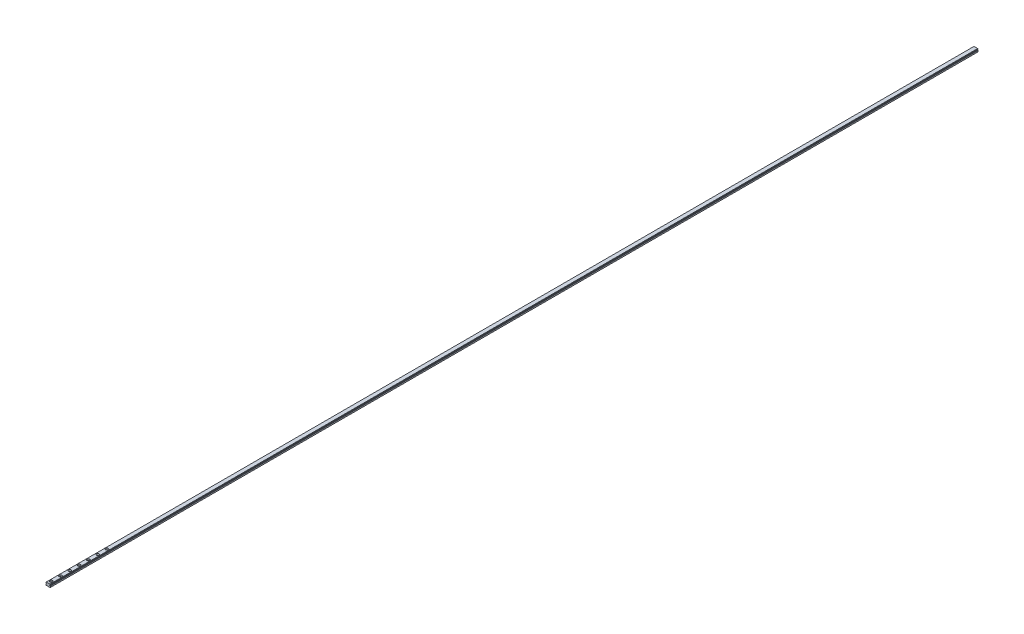
from build123d import *

# Parameters (mm, degrees)
BOSS_EXTRUDE1_DEPTH            = 750
CHAMFER1_SIZE                  = 0.5
CHAMFER2_SIZE                  = 0.3
CBORE_FOR_M2_SHCS1_D           = 2.4
CBORE_FOR_M2_SHCS1_CBORE_D     = 4.4
CBORE_FOR_M2_SHCS1_CBORE_DEPTH = 2.65
LPATTERN1_COUNT                = 7
LPATTERN1_PITCH                = 15


with BuildPart() as part:
    # Sketch3 → Boss-Extrude1 (new, symmetric)
    with BuildSketch(Plane.XY):
        with BuildLine():
            Line((-3.5, 0), (-1.35, 0))
            ThreePointArc((-1.35, 0), (-1, 0.142928579), (-0.65, 0))
            Line((-0.65, 0), (3.5, 0))
            Line((3.5, 0), (3.5, 2.83))
            Line((3.5, 2.83), (2.65, 2.83))
            ThreePointArc((2.65, 2.83), (2.315, 3.165), (2.65, 3.5))
            Line((2.65, 3.5), (3.5, 3.5))
            Line((3.5, 3.5), (3.5, 4.8))
            Line((3.5, 4.8), (-3.5, 4.8))
            Line((-3.5, 4.8), (-3.5, 3.5))
            Line((-3.5, 3.5), (-2.65, 3.5))
            ThreePointArc((-2.65, 3.5), (-2.315, 3.165), (-2.65, 2.83))
            Line((-2.65, 2.83), (-3.5, 2.83))
            Line((-3.5, 2.83), (-3.5, 0))
        make_face()
    extrude(amount=BOSS_EXTRUDE1_DEPTH, both=True)

    # Chamfer1
    chamfer1_edges = [part.edges().sort_by_distance(p)[0] for p in [
        (-3.5, 4.8, 0),
        (3.5, 4.8, 0),
    ]]
    chamfer(chamfer1_edges, length=CHAMFER1_SIZE)

    # Chamfer2
    chamfer2_edges = [part.edges().sort_by_distance(p)[0] for p in [
        (-3.5, 2.83, 0),
        (-3.5, 3.5, 0),
        (3.5, 3.5, 0),
        (3.5, 2.83, 0),
        (3.5, 0, 0),
        (-3.5, 0, 0),
    ]]
    chamfer(chamfer2_edges, length=CHAMFER2_SIZE)

    # CBORE for M2 SHCS1 (through all)
    with Locations(Plane(origin=(0, 4.8, 0), x_dir=(1, 0, 0), z_dir=(0, 1, 0))):
        with Locations((0, -745)):
            cbore_for_m2_shcs1 = CounterBoreHole(CBORE_FOR_M2_SHCS1_D / 2, CBORE_FOR_M2_SHCS1_CBORE_D / 2, CBORE_FOR_M2_SHCS1_CBORE_DEPTH)

    # LPattern1: CBORE for M2 SHCS1 ×7
    with Locations(*[(0, 0, -i * LPATTERN1_PITCH) for i in range(1, LPATTERN1_COUNT)]):
        add(cbore_for_m2_shcs1, mode=Mode.SUBTRACT)


solid = part.part
